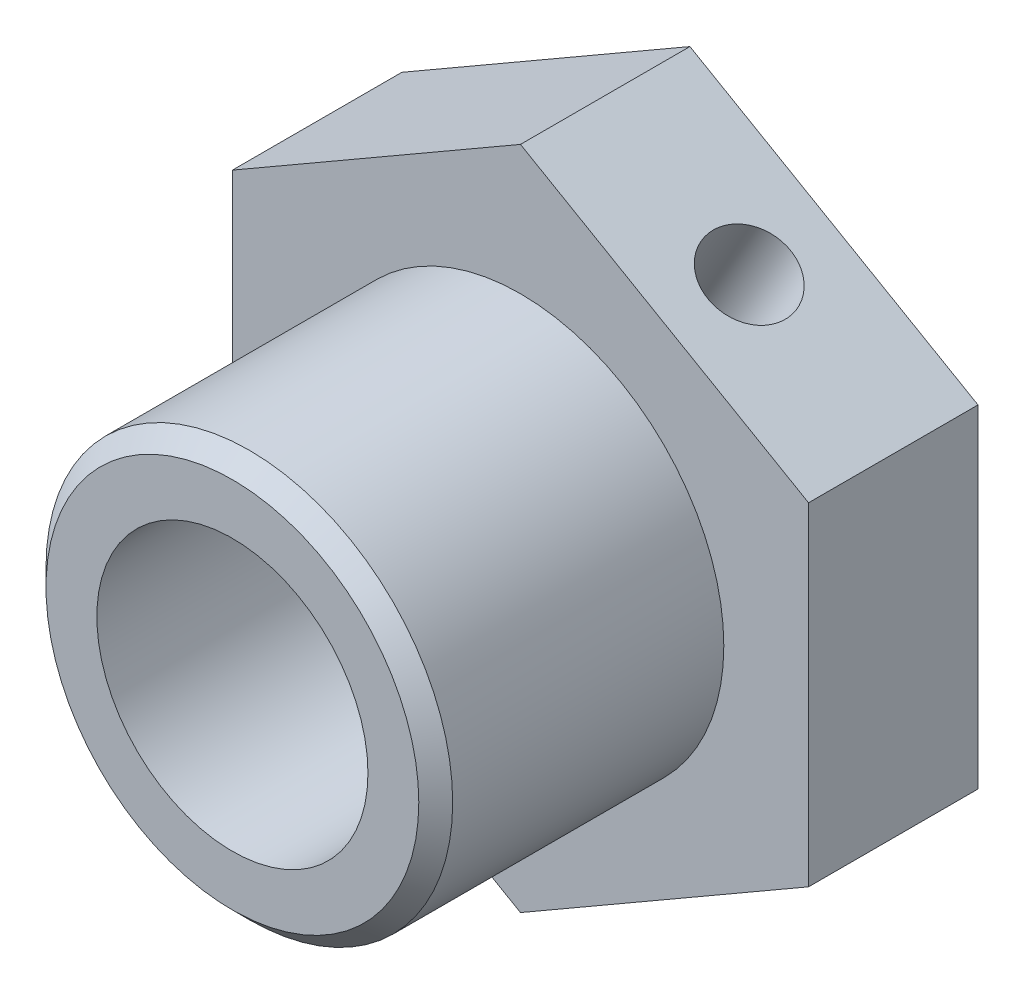
from build123d import *

# Parameters (mm, degrees)
SALIENTE_EXTRUIR1_DEPTH = 5
CROQUIS2_R              = 6
SALIENTE_EXTRUIR2_DEPTH = 8.5
CROQUIS3_R              = 4
CORTAR_EXTRUIR1_DEPTH   = 19.730545463
CHAFL_N1_SIZE           = 0.5
CROQUIS4_R              = 1.225
CORTAR_EXTRUIR2_DEPTH   = 26.294927028


with BuildPart() as part:
    # Croquis1 → Saliente-Extruir1 (new body)
    with BuildSketch(Plane.XY):
        Polygon((0, 9.814954576), (-8.5, 4.907477288), (-8.5, -4.907477288), (0, -9.814954576), (8.5, -4.907477288), (8.5, 4.907477288), align=None)
    extrude(amount=SALIENTE_EXTRUIR1_DEPTH)

    # Croquis2 → Saliente-Extruir2 (add)
    with BuildSketch(Plane.XY.offset(5)):
        Circle(CROQUIS2_R)
    extrude(amount=SALIENTE_EXTRUIR2_DEPTH)

    # Croquis3 → Cortar-Extruir1 (cut, through all)
    with BuildSketch(Plane.XY.offset(13.5)):
        Circle(CROQUIS3_R)
    extrude(amount=-CORTAR_EXTRUIR1_DEPTH, mode=Mode.SUBTRACT)

    # Chaflán1
    chafl_n1_edges = [part.edges().sort_by_distance(p)[0] for p in [
        (-6, 0, 13.5),
    ]]
    chamfer(chafl_n1_edges, length=CHAFL_N1_SIZE)

    # Croquis4 → Cortar-Extruir2 (cut, through all)
    with BuildSketch(Plane(origin=(4.25, 7.361215932, 0), x_dir=(0.8660254037844415, -0.4999999999999951, 0), z_dir=(0.49999999999999517, 0.8660254037844416, 0))):
        with Locations(Location((0, -2.5, 0), (0, 0, 180))):
            Circle(CROQUIS4_R)
    extrude(amount=-CORTAR_EXTRUIR2_DEPTH, mode=Mode.SUBTRACT)


solid = part.part
